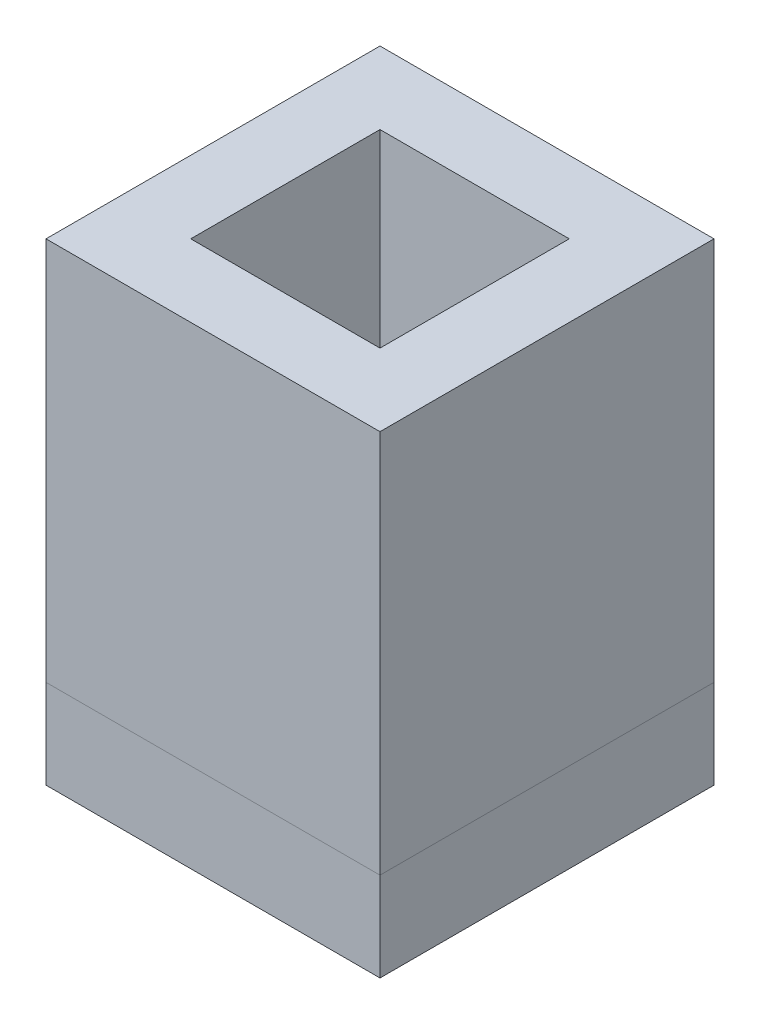
from build123d import *

# Parameters (mm, degrees)
SKETCH1_W           = 300
SKETCH1_H           = 300
BOSS_EXTRUDE1_DEPTH = 80
SKETCH2_W           = 300
SKETCH2_H           = 300
SKETCH2_W_2         = 170
SKETCH2_H_2         = 170
BOSS_EXTRUDE2_DEPTH = 345


with BuildPart() as part:
    # Sketch1 → Boss-Extrude1 (new body)
    with BuildSketch(Plane(origin=(0, 0, 0), x_dir=(1, 0, 0), z_dir=(0, 1, 0))):
        Rectangle(SKETCH1_W, SKETCH1_H)
    extrude(amount=BOSS_EXTRUDE1_DEPTH)


with BuildPart() as body_2:
    # Sketch2 → Boss-Extrude2 (new body)
    with BuildSketch(Plane(origin=(0, 80, 0), x_dir=(1, 0, 0), z_dir=(0, 1, 0))):
        Rectangle(SKETCH2_W, SKETCH2_H)
        Rectangle(SKETCH2_W_2, SKETCH2_H_2, mode=Mode.SUBTRACT)
    extrude(amount=BOSS_EXTRUDE2_DEPTH)


solid = Compound([part.part, body_2.part])
